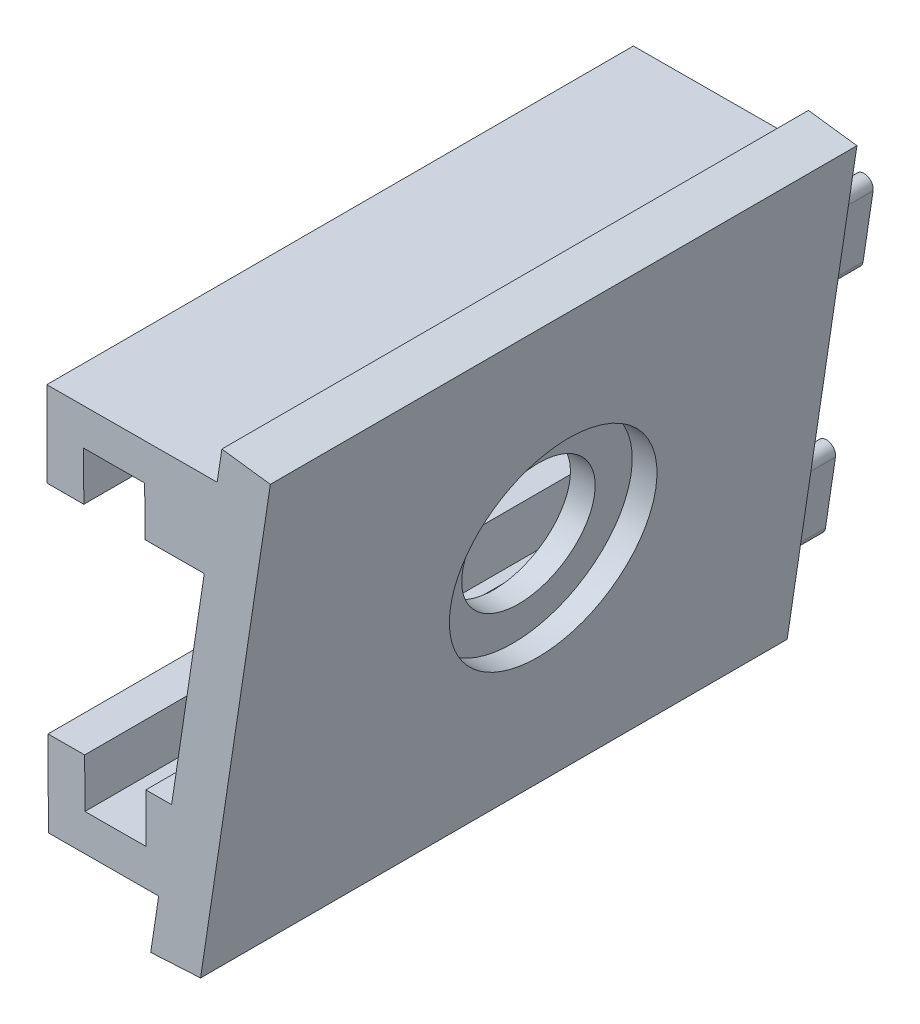
from build123d import *

# Parameters (mm, degrees)
BOSS_EXTRUDE1_DEPTH = 24
BOSS_EXTRUDE2_DEPTH = 1.75
CUT_EXTRUDE1_START  = -20.5
CUT_EXTRUDE1_DEPTH  = 20.5
SKETCH6_R           = 2.7
CUT_EXTRUDE2_DEPTH  = 29.350689779
CUT_EXTRUDE3_REACH  = 30.351
SKETCH7_R           = 4.2


with BuildPart() as part:
    # Sketch1 → Boss-Extrude1 (new body)
    with BuildSketch(Plane.XY):
        Polygon((-343.150061909, -6.552014413), (-338.636620437, -6.533511206), (-338.962584075, -8.694184464), (-336.922787571, -8.580403809), (-334.068528094, 10.339259009), (-336.052092086, 10.598219582), (-336.243956758, 9.326430897), (-343.215039679, 9.297852397), (-343.200758501, 5.814279983), (-341.700745896, 5.814279983), (-341.708902968, 7.804014317), (-339.208923976, 7.814263177), (-339.200724888, 5.814279983), (-336.772305205, 5.82423548), (-338.108271991, -3.031315789), (-339.164443925, -3.035645649), (-339.156244837, -5.035628842), (-341.656223829, -5.045877702), (-341.664422917, -3.045894508), (-343.164410312, -3.052043824), align=None)
        Polygon((-341.708902968, 7.804014317), (-341.700745896, 5.814279983), (-339.200724888, 5.814279983), (-339.208923976, 7.814263177), align=None)
        Polygon((-341.664422917, -3.045894508), (-339.164443925, -3.035645649), (-339.156244837, -5.035628842), (-341.656223829, -5.045877702), align=None)
    extrude(amount=BOSS_EXTRUDE1_DEPTH)

    # Sketch2 → Boss-Extrude2 (add)
    with BuildSketch(Plane(origin=(0, 0, 0), x_dir=(-1, 0, 0), z_dir=(0, 0, -1))):
        with BuildLine():
            Line((335.897375602, 7.434032542), (336.307604283, 4.714802425))
            ThreePointArc((336.307604283, 4.714802425), (335.992740451, 4.288058043), (335.565996069, 4.602921876))
            Line((335.565996069, 4.602921876), (335.155767388, 7.322151993))
            ThreePointArc((335.155767388, 7.322151993), (335.47063122, 7.748896374), (335.897375602, 7.434032542))
        make_face()
        with BuildLine():
            Line((337.437092292, -2.772089521), (337.847320974, -5.491319638))
            ThreePointArc((337.847320974, -5.491319638), (337.532457142, -5.918064019), (337.10571276, -5.603200187))
            Line((337.10571276, -5.603200187), (336.695484079, -2.88397007))
            ThreePointArc((336.695484079, -2.88397007), (337.010347911, -2.457225689), (337.437092292, -2.772089521))
        make_face()
    extrude(amount=BOSS_EXTRUDE2_DEPTH)

    # Sketch3 → Cut-Extrude1 (cut)
    with BuildSketch(Plane.XY.offset(24).offset(CUT_EXTRUDE1_START)):
        Polygon((-339.156244837, -5.035628842), (-341.656223829, -5.045877702), (-341.664422917, -3.045894508), (-339.164443925, -3.035645649), align=None)
        Polygon((-341.708902968, 7.804014317), (-341.700745896, 5.814279983), (-339.200724888, 5.814279983), (-339.208923976, 7.814263177), align=None)
    extrude(amount=CUT_EXTRUDE1_DEPTH, mode=Mode.SUBTRACT)

    # Sketch6 → Cut-Extrude2 (cut, through all)
    with BuildSketch(Plane(origin=(-334.020527762, -1.369343309, 0), x_dir=(0, 0, -1), z_dir=(-0.9999915968347833, -0.00409954385515742, 0))):
        with Locations(Location((-11, -2.254799372, 0), (0, 0, 270))):
            Circle(SKETCH6_R)
    extrude(amount=CUT_EXTRUDE2_DEPTH, mode=Mode.SUBTRACT)

    # Cut-Extrude3: up to this plane
    cut_extrude3_end = Plane(origin=(-329.148436726, 49.656014161, 45.350773476), z_dir=(-0.9888109516181178, 0.14917406597687244, 0))
    # Sketch7 → Cut-Extrude3 (cut, up to the surface)
    with BuildSketch(Plane(origin=(-334.020527762, -1.369343309, 0), x_dir=(0, 0, -1), z_dir=(-0.9999915968347833, -0.00409954385515742, 0)), mode=Mode.PRIVATE) as cut_extrude3_sk1:
        with Locations(Location((-11, -2.254799372, 0), (0, 0, 270))):
            Circle(SKETCH7_R)
    cut_extrude3_tool1 = split(extrude(cut_extrude3_sk1.sketch, amount=CUT_EXTRUDE3_REACH, mode=Mode.PRIVATE), bisect_by=cut_extrude3_end, keep=Keep.BOTH, mode=Mode.PRIVATE)
    add(cut_extrude3_tool1.solids().sort_by_distance((-334.029771, 0.885437, 11))[0], mode=Mode.SUBTRACT)


solid = part.part
